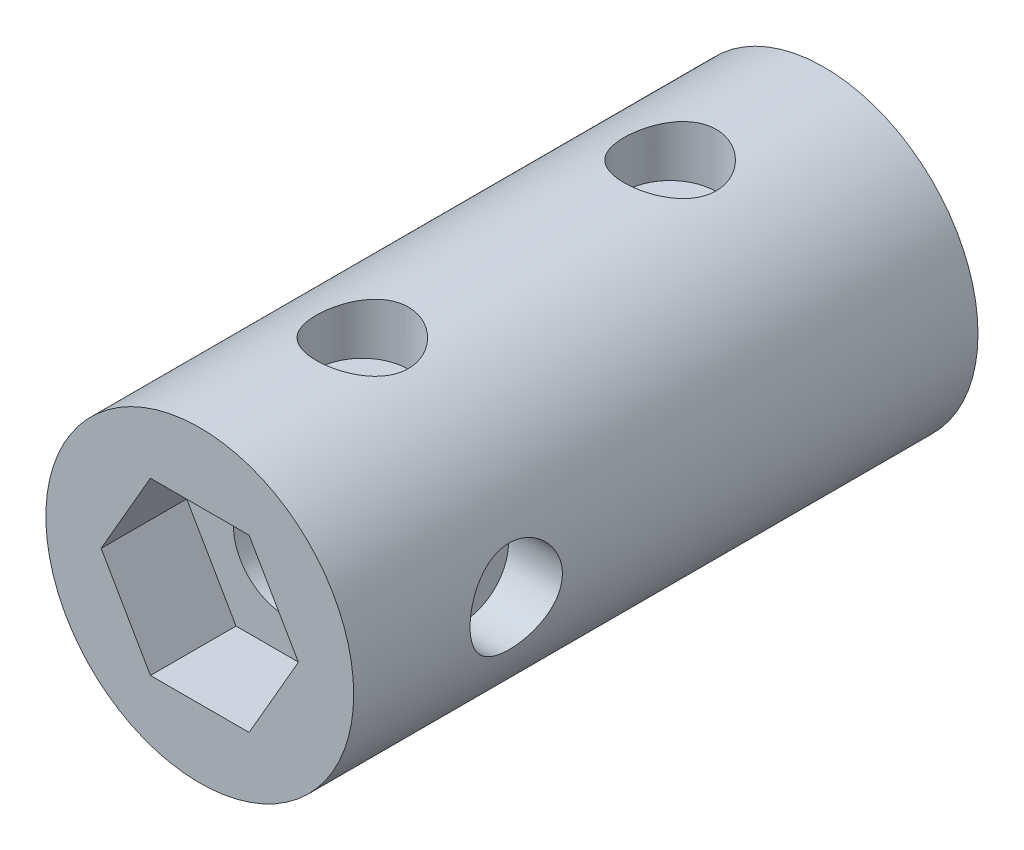
from build123d import *

# Parameters (mm, degrees)
SKETCH1_R               = 10
SKETCH1_R_2             = 2.6
BOSS_EXTRUDE1_DEPTH     = 25
BOSS_EXTRUDE2_START     = -5
SKETCH2_R               = 10
BOSS_EXTRUDE2_DEPTH     = 5
CUT_EXTRUDE1_DEPTH      = 29.722813233
CUT_EXTRUDE1_DEPTH_BACK = 29.722813233
SKETCH3_R               = 1.35
SKETCH6_R               = 10
SKETCH6_R_2             = 3.3734375
BOSS_EXTRUDE4_DEPTH     = 10
CUT_EXTRUDE2_DEPTH      = 38.74917233
CUT_EXTRUDE2_DEPTH_BACK = 38.74917233
SKETCH7_R               = 1.35
CUT_EXTRUDE3_DEPTH      = 38.74917233
CUT_EXTRUDE3_DEPTH_BACK = 38.74917233
SKETCH8_R               = 1.35
SKETCH5_R               = 10
BOSS_EXTRUDE3_DEPTH     = 5.56
CUT_EXTRUDE4_START      = -6.5
SKETCH9_R               = 3
CUT_EXTRUDE4_DEPTH      = 25.4
CUT_EXTRUDE5_START      = -6.5
SKETCH10_R              = 3
CUT_EXTRUDE5_DEPTH      = 25.4
CIRPATTERN1_COUNT       = 4


with BuildPart() as part:
    # Sketch1 → Boss-Extrude1 (new body)
    with BuildSketch(Plane.XY):
        Circle(SKETCH1_R)
        Circle(SKETCH1_R_2, mode=Mode.SUBTRACT)
    extrude(amount=BOSS_EXTRUDE1_DEPTH)

    # Sketch2 → Boss-Extrude2 (add)
    with BuildSketch(Plane.XY.offset(25).offset(BOSS_EXTRUDE2_START)):
        Circle(SKETCH2_R)
    extrude(amount=BOSS_EXTRUDE2_DEPTH)

    # Sketch3 → Cut-Extrude1 (cut, two sides: drawn at the far end of the back side and taken through both)
    with BuildSketch(Plane(origin=(0, 0, 0), x_dir=(1, 0, 0), z_dir=(0, 1, 0)).offset(-CUT_EXTRUDE1_DEPTH_BACK)):
        with Locations((0, -10)):
            Circle(SKETCH3_R)
    extrude(amount=CUT_EXTRUDE1_DEPTH + CUT_EXTRUDE1_DEPTH_BACK, mode=Mode.SUBTRACT)

    # Sketch6 → Boss-Extrude4 (add)
    with BuildSketch(Plane.XY.offset(25)):
        Circle(SKETCH6_R)
        Circle(SKETCH6_R_2, mode=Mode.SUBTRACT)
    extrude(amount=BOSS_EXTRUDE4_DEPTH)

    # Sketch7 → Cut-Extrude2 (cut, two sides: drawn at the far end of the back side and taken through both)
    with BuildSketch(Plane(origin=(0, 0, 0), x_dir=(1, 0, 0), z_dir=(0, 1, 0)).offset(-CUT_EXTRUDE2_DEPTH_BACK)):
        with Locations((0, -30)):
            Circle(SKETCH7_R)
    extrude(amount=CUT_EXTRUDE2_DEPTH + CUT_EXTRUDE2_DEPTH_BACK, mode=Mode.SUBTRACT)

    # Sketch8 → Cut-Extrude3 (cut, two sides: drawn at the far end of the back side and taken through both)
    with BuildSketch(Plane(origin=(0, 0, 0), x_dir=(0, 0, -1), z_dir=(1, 0, 0)).offset(-CUT_EXTRUDE3_DEPTH_BACK)):
        with Locations((-30, 0)):
            Circle(SKETCH8_R)
    extrude(amount=CUT_EXTRUDE3_DEPTH + CUT_EXTRUDE3_DEPTH_BACK, mode=Mode.SUBTRACT)

    # Sketch5 → Boss-Extrude3 (add)
    with BuildSketch(Plane.XY.offset(35)):
        Circle(SKETCH5_R)
        Polygon((3.204293994, -5.55), (6.408587988, 0), (3.204293994, 5.55), (-3.204293994, 5.55), (-6.408587988, 0), (-3.204293994, -5.55), align=None, mode=Mode.SUBTRACT)
    extrude(amount=BOSS_EXTRUDE3_DEPTH)

    # Sketch9 → Cut-Extrude4 (cut)
    with BuildSketch(Plane(origin=(0, 0, 0), x_dir=(1, 0, 0), z_dir=(0, 1, 0)).offset(CUT_EXTRUDE4_START)):
        with Locations((0, -10)):
            Circle(SKETCH9_R)
    cut_extrude4 = extrude(amount=-CUT_EXTRUDE4_DEPTH, mode=Mode.SUBTRACT)

    # Mirror1: Cut-Extrude4 across plane
    add(cut_extrude4.mirror(Plane.ZX), mode=Mode.SUBTRACT)

    # Sketch10 → Cut-Extrude5 (cut)
    with BuildSketch(Plane(origin=(0, 0, 0), x_dir=(1, 0, 0), z_dir=(0, 1, 0)).offset(CUT_EXTRUDE5_START)):
        with Locations((0, -30)):
            Circle(SKETCH10_R)
    cut_extrude5 = extrude(amount=-CUT_EXTRUDE5_DEPTH, mode=Mode.SUBTRACT)

    # CirPattern1: Cut-Extrude5 ×4 about axis
    cirpattern1_axis = Axis((0, 0, 40.56), (0, 0, -1))
    for i in range(1, CIRPATTERN1_COUNT):
        add(cut_extrude5.rotate(cirpattern1_axis, i * 360 / CIRPATTERN1_COUNT), mode=Mode.SUBTRACT)


solid = part.part
